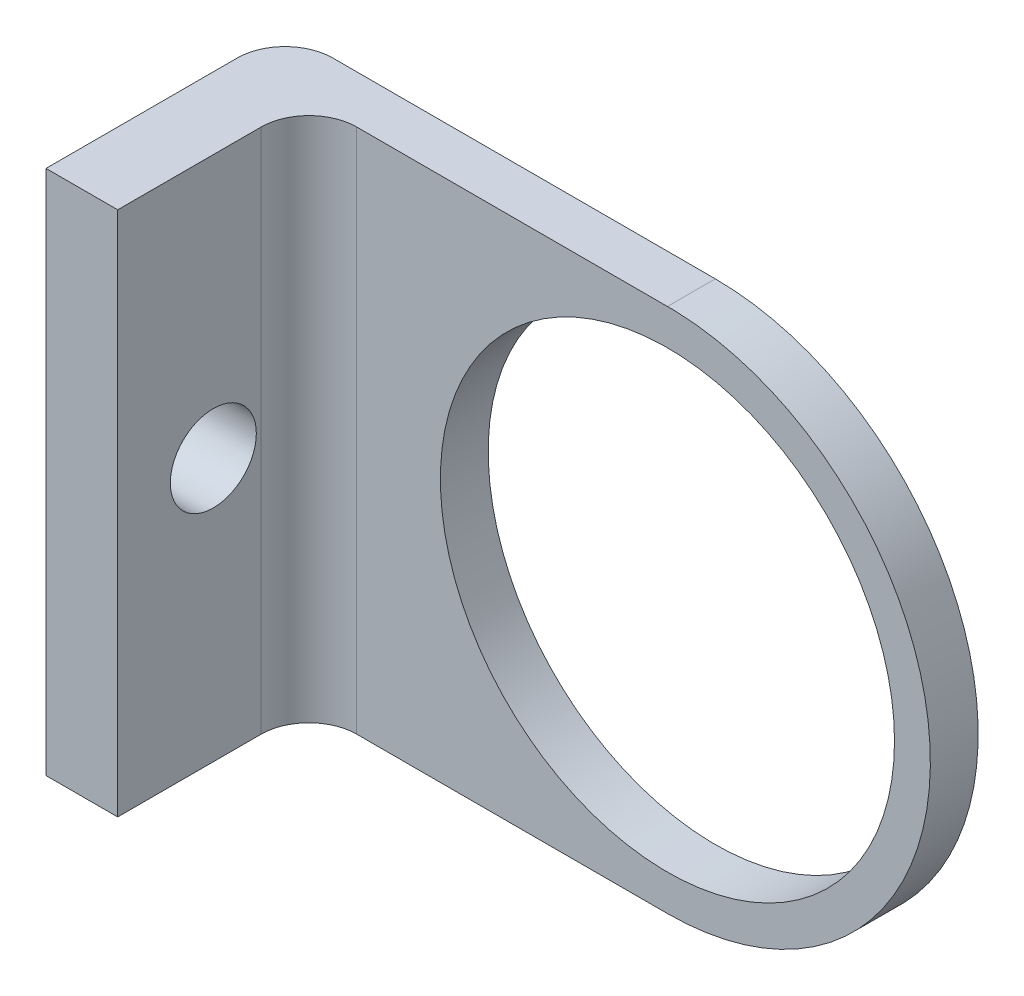
from build123d import *

# Parameters (mm, degrees)
F_10_MM_EXTRUDE_DEPTH  = 10
F_8_START              = -8
SKETCH2_R              = 9.5
F_8_MM_CUT_DEPTH       = 8
SKETCH4_R              = 1.8
CUT_EXTRUDE_3_6D_DEPTH = 8
R2_FILET_R             = 2


with BuildPart() as part:
    # Sketch1 → 10 mm extrude (new body)
    with BuildSketch(Plane(origin=(0, 0, 0), x_dir=(0, 1, 0), z_dir=(0, 0, 1))):
        with BuildLine():
            Line((-11, 18), (-11, 0))
            ThreePointArc((-11, 0), (-7.778174593, 7.778174593), (0, 11))
            Line((0, 11), (0, 18))
            Line((0, 18), (-11, 18))
        make_face()
        with BuildLine():
            Line((0, 18), (0, 11))
            ThreePointArc((0, 11), (7.778174593, 7.778174593), (11, 0))
            Line((11, 0), (11, 18))
            Line((11, 18), (0, 18))
        make_face()
        with BuildLine():
            ThreePointArc((0, 11), (-7.778174593, 7.778174593), (-11, 0))
            Line((-11, 0), (-9.5, 0))
            ThreePointArc((-9.5, 0), (-6.717514421, 6.717514421), (0, 9.5))
            Line((0, 9.5), (0, 11))
        make_face()
        with BuildLine():
            Line((-9.5, 0), (-11, 0))
            ThreePointArc((-11, 0), (-7.778174593, -7.778174593), (0, -11))
            Line((0, -11), (0, -9.5))
            ThreePointArc((0, -9.5), (-6.717514421, -6.717514421), (-9.5, 0))
        make_face()
        with BuildLine():
            ThreePointArc((11, 0), (7.778174593, 7.778174593), (0, 11))
            Line((0, 11), (0, 9.5))
            ThreePointArc((0, 9.5), (6.717514421, 6.717514421), (9.5, 0))
            Line((9.5, 0), (11, 0))
        make_face()
        with BuildLine():
            Line((0, -9.5), (0, -11))
            ThreePointArc((0, -11), (7.778174593, -7.778174593), (11, 0))
            Line((11, 0), (9.5, 0))
            ThreePointArc((9.5, 0), (6.717514421, -6.717514421), (0, -9.5))
        make_face()
    extrude(amount=F_10_MM_EXTRUDE_DEPTH)

    # Sketch2 → 8 mm cut (cut)
    with BuildSketch(Plane(origin=(0, 0, 10), x_dir=(0, -1, 0), z_dir=(0, 0, 1)).offset(F_8_START)):
        with BuildLine():
            Line((11, -15), (11, 0))
            ThreePointArc((11, 0), (0, 11), (-11, 0))
            Line((-11, 0), (-11, -15))
            Line((-11, -15), (11, -15))
        make_face()
        with Locations(Location((0, 0, 0), (0, 0, 90))):
            Circle(SKETCH2_R, mode=Mode.SUBTRACT)
    extrude(amount=F_8_MM_CUT_DEPTH, mode=Mode.SUBTRACT)

    # Sketch4 → Cut-Extrude 3.6D (cut)
    with BuildSketch(Plane.YZ.offset(-15)):
        with Locations(Location((-0.001698954, 6, 0), (0, 0, 270))):
            Circle(SKETCH4_R)
    extrude(amount=-CUT_EXTRUDE_3_6D_DEPTH, mode=Mode.SUBTRACT)

    # R2 Filet
    r2_filet_edges = [part.edges().sort_by_distance(p)[0] for p in [
        (-15, 0, 2),
        (-18, 0, 0),
    ]]
    fillet(r2_filet_edges, radius=R2_FILET_R)


solid = part.part
